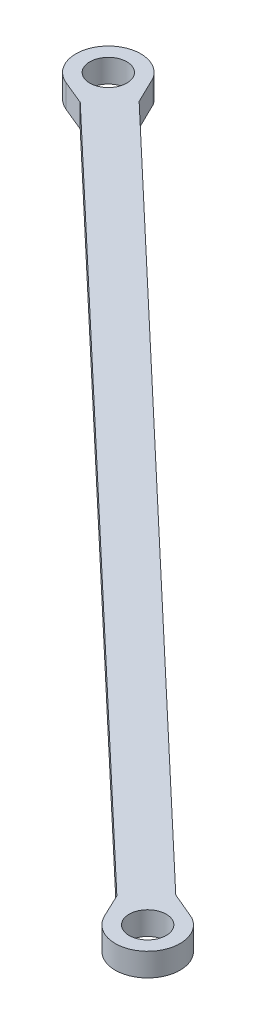
from build123d import *

# Parameters (mm, degrees)
SKETCH_1_R      = 4
EXTRUDE_1_DEPTH = 5


with BuildPart() as part:
    # 草图1 → 凸台-拉伸1 (new body)
    with BuildSketch(Plane(origin=(0, 0, 0), x_dir=(1, 0, 0), z_dir=(0, 1, 0))):
        with BuildLine():
            Line((-76.197907508, 60.368596958), (-79.079757453, 66.278376643))
            ThreePointArc((-79.079757453, 66.278376643), (-90.335533029, 66.937484633), (-87.619490015, 55.994449518))
            Line((-87.619490015, 55.994449518), (-82.39006252, 53.837347743))
            Line((-82.39006252, 53.837347743), (70.005752496, -90.646269203))
            Line((70.005752496, -90.646269203), (72.438335487, -95.753376015))
            ThreePointArc((72.438335487, -95.753376015), (83.510505182, -97.882687035), (82.252798454, -86.677996903))
            Line((82.252798454, -86.677996903), (76.197907508, -84.115019988))
            Line((76.197907508, -84.115019988), (-76.197907508, 60.368596958))
        make_face()
        with Locations(Location((-84.950212753, 62.465535895, 0), (0, 0, 270))):
            Circle(SKETCH_1_R, mode=Mode.SUBTRACT)
        with Locations(Location((78.758057741, -92.74320814, 0), (0, 0, 270))):
            Circle(SKETCH_1_R, mode=Mode.SUBTRACT)
    extrude(amount=EXTRUDE_1_DEPTH)


solid = part.part
